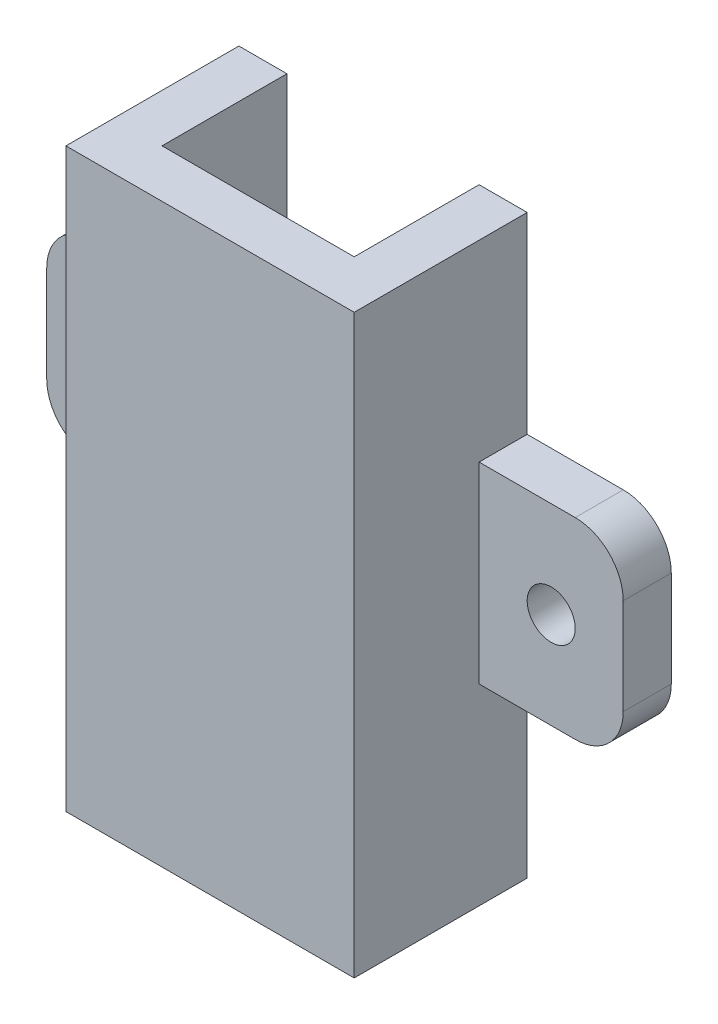
from build123d import *

# Parameters (mm, degrees)
BOSS_EXTRUDE1_DEPTH = 76.2
SKETCH3_R           = 2.5019
BOSS_EXTRUDE2_DEPTH = 6.35
SKETCH4_W           = 19.05
SKETCH4_H           = 25.4
SKETCH4_R           = 3.175
BOSS_EXTRUDE3_DEPTH = 6.35
FILLET1_R           = 6.35
CUT_EXTRUDE1_REACH  = 99.955


with BuildPart() as part:
    # Sketch2 → Boss-Extrude1 (new body)
    with BuildSketch(Plane(origin=(0, 0, 0), x_dir=(1, 0, 0), z_dir=(0, 1, 0))):
        Polygon((0, 22.86), (0, 0), (38.1, 0), (38.1, 22.86), (31.75, 22.86), (31.75, 6.35), (6.35, 6.35), (6.35, 22.86), align=None)
    extrude(amount=BOSS_EXTRUDE1_DEPTH)

    # Sketch3 → Boss-Extrude2 (add)
    with BuildSketch(Plane.XY):
        with BuildLine():
            Line((19.05, 50.8), (-19.05, 50.8))
            ThreePointArc((-19.05, 50.8), (-31.75, 38.1), (-19.05, 25.4))
            Line((-19.05, 25.4), (19.05, 25.4))
            ThreePointArc((19.05, 25.4), (31.75, 38.1), (19.05, 50.8))
        make_face()
        with Locations((-19.05, 38.1)):
            Circle(SKETCH3_R, mode=Mode.SUBTRACT)
    extrude(amount=-BOSS_EXTRUDE2_DEPTH)

    # Sketch4 → Boss-Extrude3 (add)
    # profile 1 of 2: a face of its own
    with BuildSketch(Plane(origin=(0, 0, -22.86), x_dir=(-1, 0, 0), z_dir=(0, 0, -1))):
        with Locations((-47.625, 38.1)):
            Rectangle(SKETCH4_W, SKETCH4_H)
        with Locations((-47.625, 38.1)):
            Circle(SKETCH4_R, mode=Mode.SUBTRACT)
    # profile 2 of 2: a face of its own
    with BuildSketch(Plane(origin=(0, 0, -22.86), x_dir=(-1, 0, 0), z_dir=(0, 0, -1))):
        with Locations((9.525, 38.1)):
            Rectangle(SKETCH4_W, SKETCH4_H)
        with Locations(Location((9.525, 38.1, 0), (0, 0, 180))):
            Circle(SKETCH4_R, mode=Mode.SUBTRACT)
    extrude(amount=-BOSS_EXTRUDE3_DEPTH)

    # Fillet1
    fillet1_edges = [part.edges().sort_by_distance(p)[0] for p in [
        (57.15, 25.4, -19.685),
        (57.15, 50.8, -19.685),
        (-19.05, 50.8, -19.685),
        (-19.05, 25.4, -19.685),
    ]]
    fillet(fillet1_edges, radius=FILLET1_R)

    # Sketch5 → Cut-Extrude1 (cut, up to next)
    with BuildSketch(Plane.XY, mode=Mode.PRIVATE) as cut_extrude1_sk1:
        with BuildLine():
            Line((-19.05, 25.4), (0, 25.4))
            Line((0, 25.4), (0, 50.8))
            Line((0, 50.8), (-19.05, 50.8))
            ThreePointArc((-19.05, 50.8), (-31.75, 38.1), (-19.05, 25.4))
        make_face()
    cut_extrude1_tool1 = extrude(cut_extrude1_sk1.sketch, amount=-CUT_EXTRUDE1_REACH, mode=Mode.PRIVATE) & part.part
    add(cut_extrude1_tool1.solids().sort_by_distance((-14.650694, 38.1, 0))[0], mode=Mode.SUBTRACT)


solid = part.part
